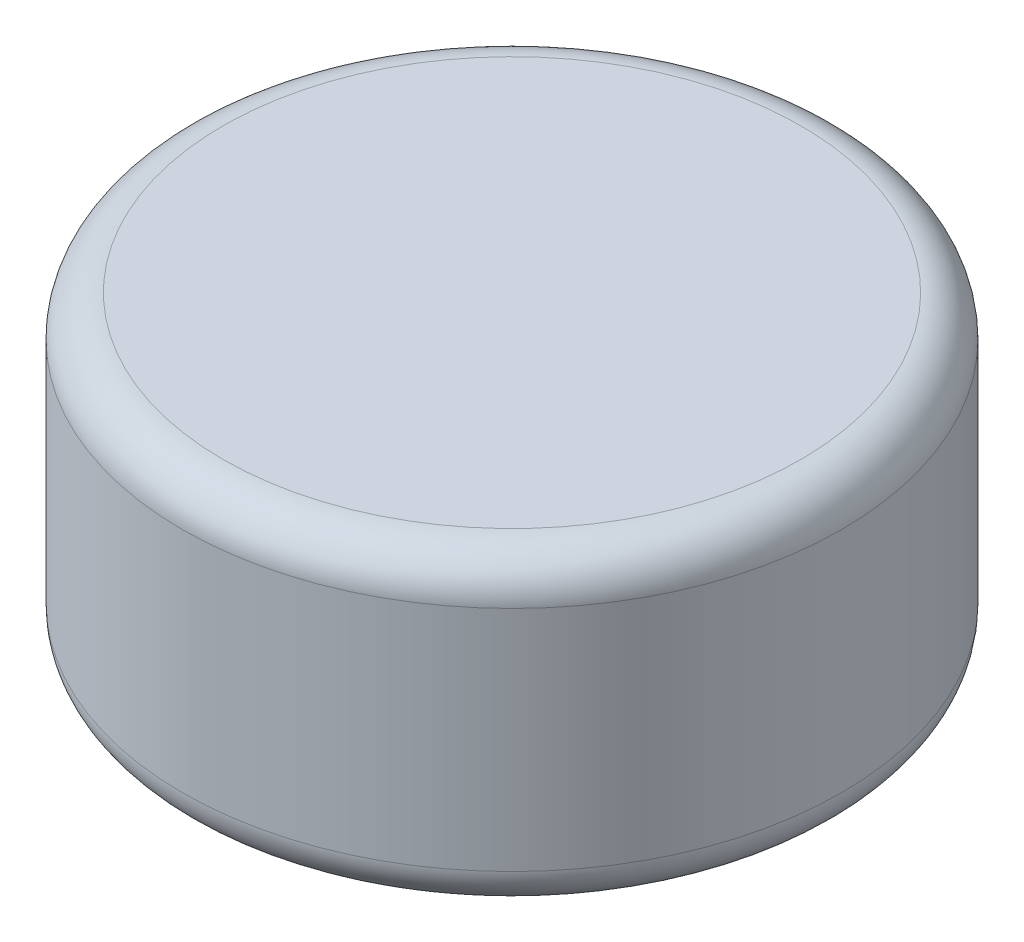
from build123d import *

# Parameters (mm, degrees)
SKETCH1_R           = 40.64
BOSS_EXTRUDE1_DEPTH = 38.100000066
FILLET1_R           = 5
SKETCH2_R           = 3.175
CUT_EXTRUDE1_DEPTH  = 25.4


with BuildPart() as part:
    # Sketch1 → Boss-Extrude1 (new body)
    with BuildSketch(Plane(origin=(0, 0, 0), x_dir=(1, 0, 0), z_dir=(0, 1, 0))):
        with Locations(Location((0, 0, 0), (0, 0, 90))):
            Circle(SKETCH1_R)
    extrude(amount=BOSS_EXTRUDE1_DEPTH)

    # Fillet1
    fillet1_edges = [part.edges().sort_by_distance(p)[0] for p in [
        (0, 0, 40.64),
        (0, 38.100000066, 40.64),
    ]]
    fillet(fillet1_edges, radius=FILLET1_R)

    # Sketch2 → Cut-Extrude1 (cut)
    with BuildSketch(Plane.XZ):
        with Locations(Location((1.587001014, -0.118729115, 0), (0, 0, 270))):
            Circle(SKETCH2_R)
    extrude(amount=-CUT_EXTRUDE1_DEPTH, mode=Mode.SUBTRACT)


solid = part.part
